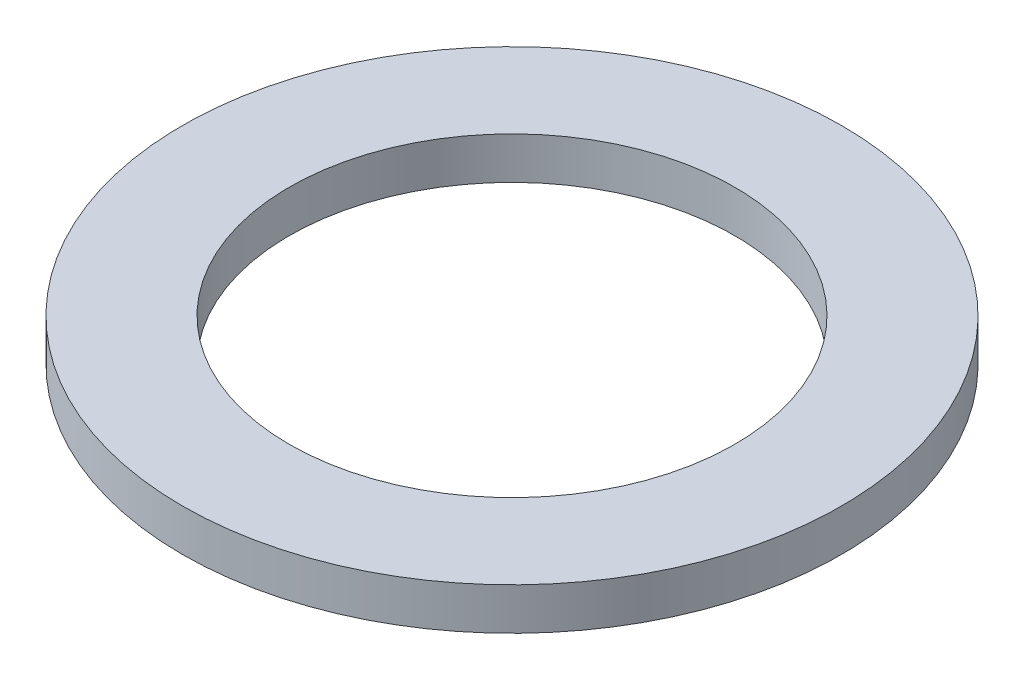
from build123d import *

# Parameters (mm, degrees)
SKETCH1_R           = 39.22
SKETCH1_R_2         = 26.51
BOSS_EXTRUDE1_DEPTH = 5


with BuildPart() as part:
    # Sketch1 → Boss-Extrude1 (new body)
    with BuildSketch(Plane(origin=(0, 0, 0), x_dir=(1, 0, 0), z_dir=(0, 1, 0))):
        with Locations(Location((0, 0, 0), (0, 0, 270))):
            Circle(SKETCH1_R)
        with Locations(Location((0, 0, 0), (0, 0, 270))):
            Circle(SKETCH1_R_2, mode=Mode.SUBTRACT)
    extrude(amount=BOSS_EXTRUDE1_DEPTH)


solid = part.part
